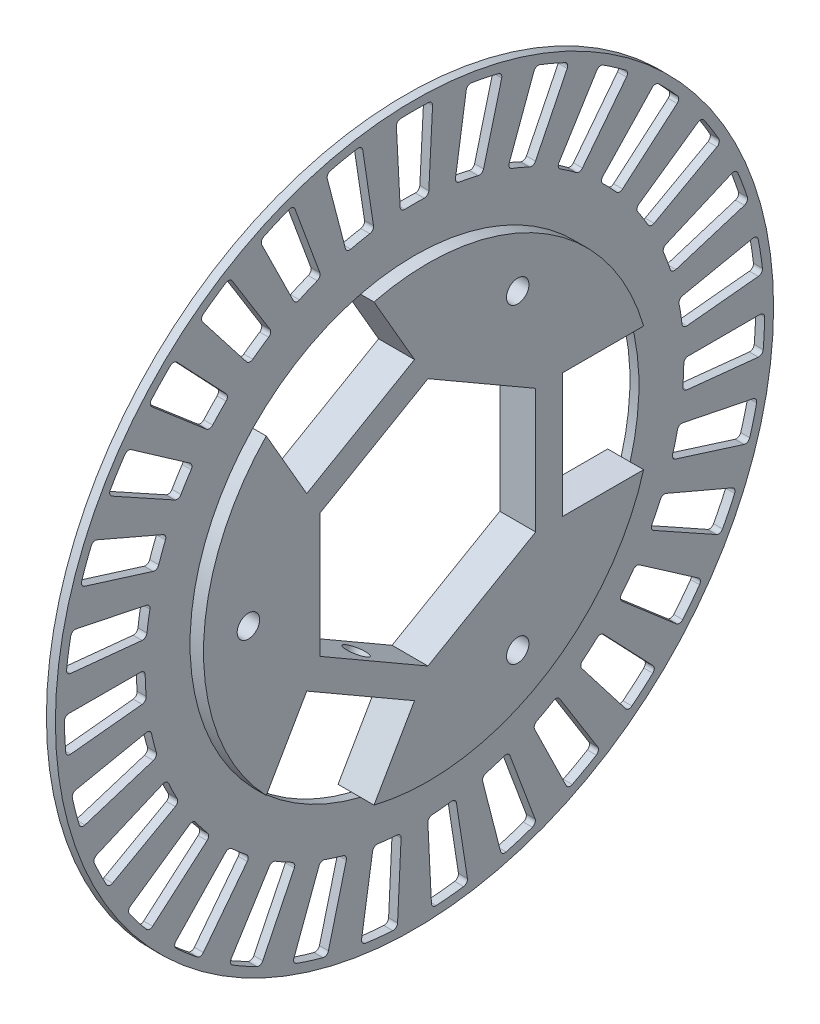
from build123d import *

# Parameters (mm, degrees)
CUT_EXTRUDE1_DEPTH       = 57.709787515
SKETCH9_R                = 1.25
CUT_EXTRUDE3_DEPTH       = 57.709787515
CUT_EXTRUDE4_DEPTH       = 57.623758265
FILLET1_R                = 0.5
CIRPATTERN4_COUNT        = 31
FILLET1_OF_CIRPATTERN4_R = 0.5
CIRPATTERN6_COUNT        = 3
M2_CLEARANCE_HOLE1_D     = 2.4
M2_CLEARANCE_HOLE1_DEPTH = 3


with BuildPart() as part:
    # Sketch3 → Revolve1 (revolve)
    with BuildSketch(Plane.XY, mode=Mode.PRIVATE) as revolve1_sk:
        Polygon((-2, 0), (2, 0), (2, 25), (0.5, 25), (0.5, 40), (-0.5, 40), (-0.5, 25), (-2, 25), align=None)
    revolve(revolve1_sk.sketch.rotate(Axis((-2, 0, 0), (1, 0, 0)), 90), axis=Axis((-2, 0, 0), (1, 0, 0)))

    # Sketch4 → Cut-Extrude1 (cut, through all)
    with BuildSketch(Plane(origin=(2, 0, 0), x_dir=(0, 0, -1), z_dir=(1, 0, 0))):
        Polygon((0, 13.856406461), (-12, 6.92820323), (-12, -6.92820323), (0, -13.856406461), (12, -6.92820323), (12, 6.92820323), align=None)
    extrude(amount=-CUT_EXTRUDE1_DEPTH, mode=Mode.SUBTRACT)

    # Sketch9 → Cut-Extrude3 (cut, through all)
    with BuildSketch(Plane(origin=(2, 0, 0), x_dir=(0, 0, -1), z_dir=(1, 0, 0))):
        with BuildLine():
            Line((-6.010412149, -24.266745678), (-1.5, -16.454482672))
            Line((-1.5, -16.454482672), (-13.5, -9.526279442))
            Line((-13.5, -9.526279442), (-18.010412149, -17.338542448))
            ThreePointArc((-18.010412149, -17.338542448), (-12.5, -21.650635095), (-6.010412149, -24.266745678))
        make_face()
        with Locations((-20, 0)):
            Circle(SKETCH9_R)
    cut_extrude3 = extrude(amount=-CUT_EXTRUDE3_DEPTH, mode=Mode.SUBTRACT)

    # Sketch10 → Cut-Extrude4 (cut, through all)
    with BuildSketch(Plane(origin=(0.5, 0, 0), x_dir=(0, 0, -1), z_dir=(1, 0, 0))):
        with BuildLine():
            ThreePointArc((-1.570078687, 29.958886043), (-0.785308449, 29.989719749), (0, 30))
            Line((0, 30), (0, 39))
            ThreePointArc((0, 39), (-1.020900984, 38.986635674), (-2.041102293, 38.946551855))
            Line((-2.041102293, 38.946551855), (-1.570078687, 29.958886043))
        make_face()
        with BuildLine():
            Line((0, 39), (0, 30))
            ThreePointArc((0, 30), (0.785308449, 29.989719749), (1.570078687, 29.958886043))
            Line((1.570078687, 29.958886043), (2.041102293, 38.946551855))
            ThreePointArc((2.041102293, 38.946551855), (1.020900984, 38.986635674), (0, 39))
        make_face()
    cut_extrude4 = extrude(amount=-CUT_EXTRUDE4_DEPTH, mode=Mode.SUBTRACT)

    # Fillet1
    fillet1_edges = [part.edges().sort_by_distance(p)[0] for p in [
        (0, 29.958886043, -1.570078687),
        (0, 29.958886043, 1.570078687),
        (0, 38.946551855, 2.041102293),
        (0, 38.946551855, -2.041102293),
    ]]
    fillet(fillet1_edges, radius=FILLET1_R)

    # CirPattern4: Cut-Extrude4 ×31 about axis
    cirpattern4_axis = Axis((0, 0, 0), (1, 0, 0))
    for i in range(1, CIRPATTERN4_COUNT):
        add(cut_extrude4.rotate(cirpattern4_axis, i * 360 / CIRPATTERN4_COUNT), mode=Mode.SUBTRACT)

    # Fillet1 of CirPattern4
    fillet1_of_cirpattern4_edges = [part.edges().sort_by_distance(p)[0] for p in [
        (0, 29.661680402, 4.49274034),
        (0, 29.029571369, 7.568618508),
        (0, 37.73844278, 9.839204061),
        (0, 38.560184522, 5.840562441),
        (0, 28.15012208, 10.371626049),
        (0, 26.911782633, 13.257298198),
        (0, 34.985317423, 17.234487658),
        (0, 36.595158704, 13.483113864),
        (0, 25.486094452, 15.825896169),
        (0, 23.692222354, 18.403222542),
        (0, 30.79988906, 23.924189305),
        (0, 33.131922788, 20.57366502),
        (0, 21.778663124, 20.632252241),
        (0, 19.502699708, 22.795716793),
        (0, 25.35350962, 29.634431831),
        (0, 28.312262061, 26.821927914),
        (0, 17.179610768, 24.593921482),
        (0, 14.514734244, 26.25495172),
        (0, 18.869154518, 34.131437236),
        (0, 22.333493998, 31.972097927),
        (0, 11.877223129, 27.548712688),
        (0, 8.932533855, 28.639305839),
        (0, 11.612294012, 37.23109759),
        (0, 15.440390067, 35.813326494),
        (0, 6.088580579, 29.375656359),
        (0, 2.984634481, 29.851163411),
        (0, 3.880024825, 38.806512435),
        (0, 7.915154753, 38.188353267),
        (0, 0.050670825, 29.999957208),
        (0, -3.08545618, 29.840910847),
        (0, -4.011093034, 38.793184101),
        (0, 0.065872073, 38.99994437),
        (0, -5.989313398, 29.396056283),
        (0, -9.029227902, 28.608967886),
        (0, -11.737996273, 37.191658252),
        (0, -7.786107418, 38.214873168),
        (0, -11.784094427, 27.588677361),
        (0, -14.603341973, 26.205770418),
        (0, -18.984344565, 34.067501544),
        (0, -15.319322756, 35.865280569),
        (0, -17.096433246, 24.651814746),
        (0, -19.579593508, 22.729705631),
        (0, -25.453471561, 29.54861732),
        (0, -22.22536322, 32.047359169),
        (0, -21.708842079, 20.705703938),
        (0, -23.754254184, 18.323084024),
        (0, -30.88053044, 23.820009231),
        (0, -28.221494703, 26.91741512),
        (0, -25.432488367, 15.911899179),
        (0, -26.956412903, 13.166313204),
        (0, -35.043336774, 17.116207166),
        (0, -33.062234877, 20.685468933),
        (0, -28.114925592, 10.466659398),
        (0, -29.05497291, 7.470511975),
        (0, -37.771464784, 9.711665568),
        (0, -36.54940327, 13.606657217),
        (0, -29.646334461, 4.592913351),
        (0, -29.964018913, 1.468867108),
        (0, -38.953224587, 1.909527241),
        (0, -38.540234799, 5.970787356),
        (0, -29.964018913, -1.468867108),
        (0, -29.646334461, -4.592913351),
        (0, -38.540234799, -5.970787356),
        (0, -38.953224587, -1.909527241),
        (0, -29.05497291, -7.470511975),
        (0, -28.114925592, -10.466659398),
        (0, -36.54940327, -13.606657217),
        (0, -37.771464784, -9.711665568),
        (0, -26.956412903, -13.166313204),
        (0, -25.432488367, -15.911899179),
        (0, -33.062234877, -20.685468933),
        (0, -35.043336774, -17.116207166),
        (0, -23.754254184, -18.323084024),
        (0, -21.708842079, -20.705703938),
        (0, -28.221494703, -26.91741512),
        (0, -30.88053044, -23.820009231),
        (0, -19.579593508, -22.729705631),
        (0, -17.096433246, -24.651814746),
        (0, -22.22536322, -32.047359169),
        (0, -25.453471561, -29.54861732),
        (0, -14.603341973, -26.205770418),
        (0, -11.784094427, -27.588677361),
        (0, -15.319322756, -35.865280569),
        (0, -18.984344565, -34.067501544),
        (0, -9.029227902, -28.608967886),
        (0, -5.989313398, -29.396056283),
        (0, -7.786107418, -38.214873168),
        (0, -11.737996273, -37.191658252),
        (0, -3.08545618, -29.840910847),
        (0, 0.050670825, -29.999957208),
        (0, 0.065872073, -38.99994437),
        (0, -4.011093034, -38.793184101),
        (0, 2.984634481, -29.851163411),
        (0, 6.088580579, -29.375656359),
        (0, 7.915154753, -38.188353267),
        (0, 3.880024825, -38.806512435),
        (0, 8.932533855, -28.639305839),
        (0, 11.877223129, -27.548712688),
        (0, 15.440390067, -35.813326494),
        (0, 11.612294012, -37.23109759),
        (0, 14.514734244, -26.25495172),
        (0, 17.179610768, -24.593921482),
        (0, 22.333493998, -31.972097927),
        (0, 18.869154518, -34.131437236),
        (0, 19.502699708, -22.795716793),
        (0, 21.778663124, -20.632252241),
        (0, 28.312262061, -26.821927914),
        (0, 25.35350962, -29.634431831),
        (0, 23.692222354, -18.403222542),
        (0, 25.486094452, -15.825896169),
        (0, 33.131922788, -20.57366502),
        (0, 30.79988906, -23.924189305),
        (0, 26.911782633, -13.257298198),
        (0, 28.15012208, -10.371626049),
        (0, 36.595158704, -13.483113864),
        (0, 34.985317423, -17.234487658),
        (0, 29.029571369, -7.568618508),
        (0, 29.661680402, -4.49274034),
        (0, 38.560184522, -5.840562441),
        (0, 37.73844278, -9.839204061),
    ]]
    fillet(fillet1_of_cirpattern4_edges, radius=FILLET1_OF_CIRPATTERN4_R)

    # CirPattern6: Cut-Extrude3 ×3 about axis
    cirpattern6_axis = Axis((0, 0, 0), (1, 0, 0))
    for i in range(1, CIRPATTERN6_COUNT):
        add(cut_extrude3.rotate(cirpattern6_axis, i * 360 / CIRPATTERN6_COUNT), mode=Mode.SUBTRACT)

    # M2 Clearance Hole1
    with Locations(Plane(origin=(0, -12.990381057, 7.5), x_dir=(-1, 0, 0), z_dir=(0, -0.8660254037844387, 0.49999999999999983))):
        with Locations((0, 0)):
            Hole(M2_CLEARANCE_HOLE1_D / 2, depth=M2_CLEARANCE_HOLE1_DEPTH)


solid = part.part
